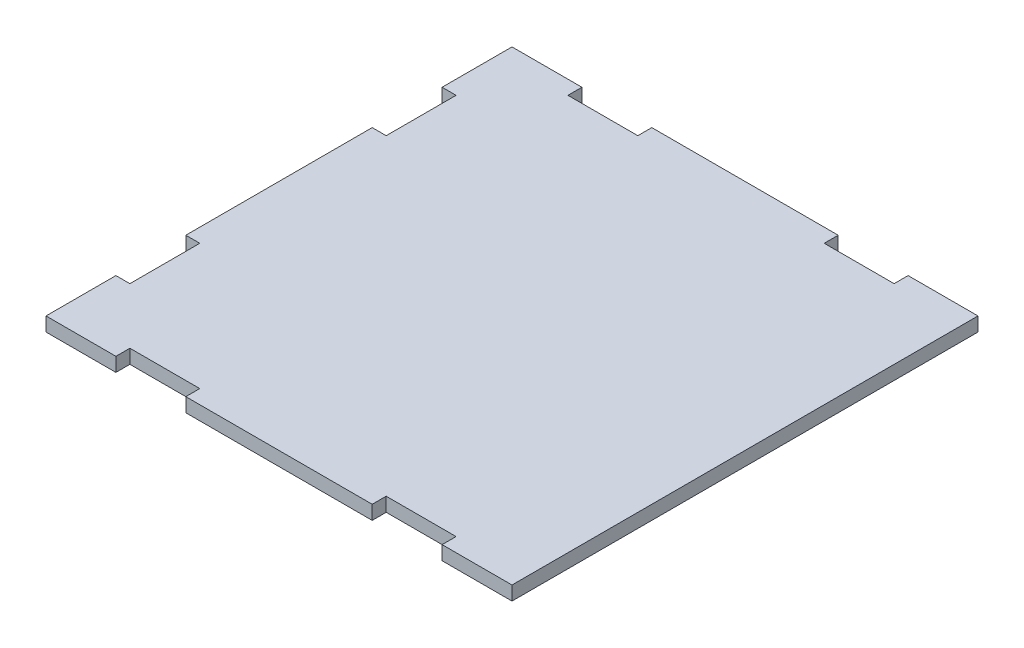
from build123d import *

# Parameters (mm, degrees)
ESBO_O1_W                = 200
ESBO_O1_H                = 200
RESSALTO_EXTRUS_O1_DEPTH = 6
ESBO_O2_W                = 30
ESBO_O2_H                = 6
ESBO_O2_W_2              = 6
ESBO_O2_H_2              = 30
CORTE_EXTRUS_O1_DEPTH    = 10


with BuildPart() as part:
    # Esboço1 → Ressalto-extrusão1 (new body)
    with BuildSketch(Plane(origin=(0, 0, 0), x_dir=(1, 0, 0), z_dir=(0, 1, 0))):
        Rectangle(ESBO_O1_W, ESBO_O1_H)
    extrude(amount=RESSALTO_EXTRUS_O1_DEPTH)

    # Esboço2 → Corte-extrusão1 (cut)
    with BuildSketch(Plane(origin=(0, 6, 0), x_dir=(1, 0, 0), z_dir=(0, 1, 0))):
        with Locations((-55, -97)):
            Rectangle(ESBO_O2_W, ESBO_O2_H)
        with Locations((55, -97)):
            Rectangle(ESBO_O2_W, ESBO_O2_H)
        with Locations((-55, 97)):
            Rectangle(ESBO_O2_W, ESBO_O2_H)
        with Locations((55, 97)):
            Rectangle(ESBO_O2_W, ESBO_O2_H)
        with Locations((-97, 55)):
            Rectangle(ESBO_O2_W_2, ESBO_O2_H_2)
        with Locations((-97, -55)):
            Rectangle(ESBO_O2_W_2, ESBO_O2_H_2)
    extrude(amount=-CORTE_EXTRUS_O1_DEPTH, mode=Mode.SUBTRACT)


solid = part.part
